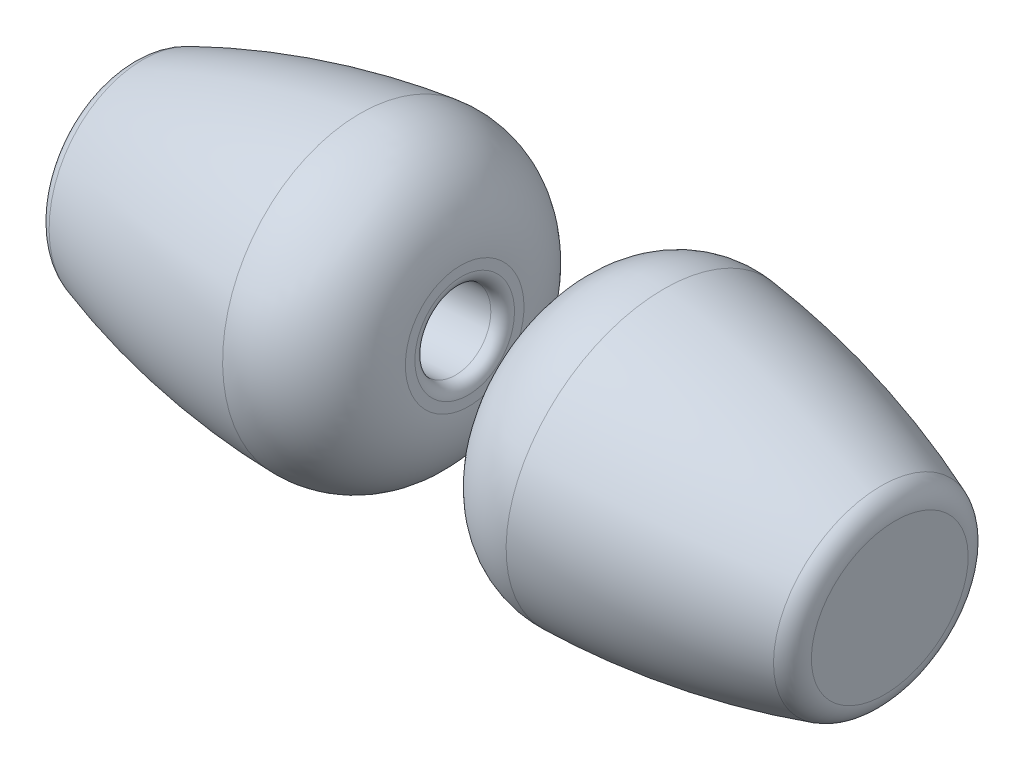
from build123d import *

# Parameters (mm, degrees)
REDONDEO1_R           = 1
CROQUIS10_R           = 1.6
CORTAR_EXTRUIR2_DEPTH = 10
REDONDEO2_R           = 0.5


with BuildPart() as part:
    # Croquis9 → Revolución1 (revolve)
    with BuildSketch(Plane.XY):
        with BuildLine():
            Line((2, 157.811076058), (2.172690038, 160.305104556))
            ThreePointArc((2.172690038, 160.305104556), (3.548041005, 162.949346806), (6.420443791, 163.744902958))
            ThreePointArc((6.420443791, 163.744902958), (11.439366208, 162.653197494), (16.242863651, 160.834457444))
            Line((16.242863651, 160.834457444), (15.966559591, 156.844011847))
            Line((15.966559591, 156.844011847), (2, 157.811076058))
        make_face()
    revolve(axis=Axis((15.966559591, 156.844011847, 0), (-0.9976113993662253, 0.06907601504546812, 0)))

    # Redondeo1
    redondeo1_edges = [part.edges().sort_by_distance(p)[0] for p in [
        (15.690255531, 152.853566249, 0),
    ]]
    fillet(redondeo1_edges, radius=REDONDEO1_R)

    # Croquis10 → Cortar-Extruir2 (cut)
    with BuildSketch(Plane(origin=(-8.884465215, 0.615172855, 0), x_dir=(0, 0, 1), z_dir=(-0.9976113993662253, 0.06907601504546812, 0))):
        with Locations(Location((0, 157.572280451, 0), (0, 0, 270))):
            Circle(CROQUIS10_R)
    extrude(amount=-CORTAR_EXTRUIR2_DEPTH, mode=Mode.SUBTRACT)

    # Redondeo2
    redondeo2_edges = [part.edges().sort_by_distance(p)[0] for p in [
        (2.110521624, 159.407254297, 0),
    ]]
    fillet(redondeo2_edges, radius=REDONDEO2_R)


with BuildPart() as body_2:
    # Simetría6: mirrored copy
    add(part.part.mirror(Plane(origin=(0, 0, 0), x_dir=(0, 0, 1), z_dir=(1, 0, 0))))


solid = Compound([part.part, body_2.part])
